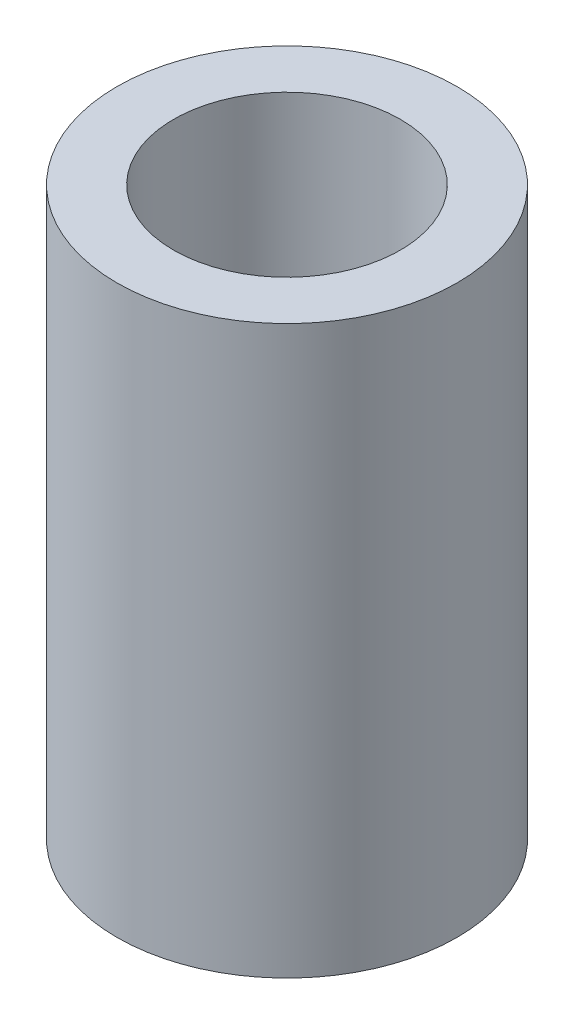
from build123d import *

# Parameters (mm, degrees)
SKETCH1_R           = 1.5
SKETCH1_R_2         = 1
BOSS_EXTRUDE1_DEPTH = 5


with BuildPart() as part:
    # Sketch1 → Boss-Extrude1 (new body)
    with BuildSketch(Plane(origin=(0, 0, 0), x_dir=(1, 0, 0), z_dir=(0, 1, 0))):
        with Locations(Location((0, 0, 0), (0, 0, 270))):
            Circle(SKETCH1_R)
        with Locations(Location((0, 0, 0), (0, 0, 270))):
            Circle(SKETCH1_R_2, mode=Mode.SUBTRACT)
    extrude(amount=BOSS_EXTRUDE1_DEPTH)


solid = part.part
